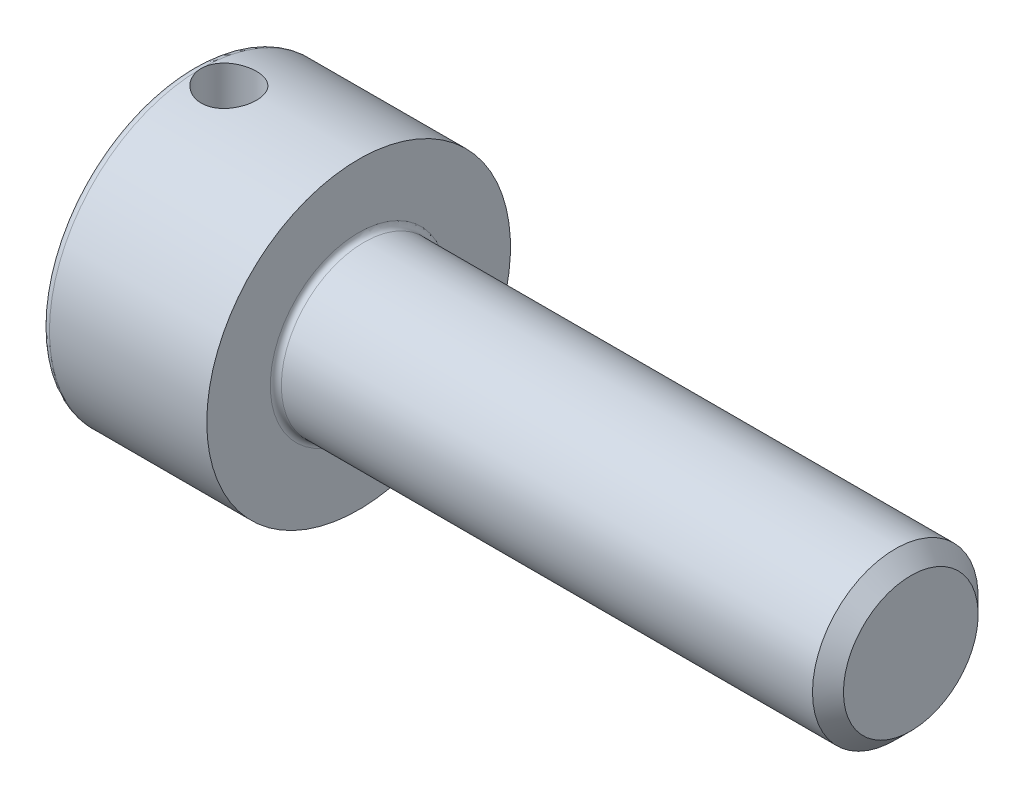
from build123d import *

# Parameters (mm, degrees)
FILLET1_R               = 0.1
FILLET2_R               = 0.15
HEX_2_DEPTH             = 1.3
CUT_EXTRUDE1_DEPTH      = 14.569266765
CUT_EXTRUDE1_DEPTH_BACK = 14.569266765
SKETCH4_R               = 0.5


with BuildPart() as part:
    # BodySke → Base-Revolve (revolve)
    with BuildSketch(Plane.XY, mode=Mode.PRIVATE) as base_revolve_sk:
        Polygon((0, 0), (0, 2.75), (3, 2.75), (3, 1.5), (12.7195, 1.5), (13, 1.2195), (13, 0), align=None)
    revolve(base_revolve_sk.sketch.rotate(Axis((-31.75, 0, 0), (1, 0, 0)), 90), axis=Axis((-31.75, 0, 0), (1, 0, 0)))

    # Fillet1
    fillet1_edges = [part.edges().sort_by_distance(p)[0] for p in [
        (3, 0, -1.5),
    ]]
    fillet(fillet1_edges, radius=FILLET1_R)

    # Fillet2
    fillet2_edges = [part.edges().sort_by_distance(p)[0] for p in [
        (0, 0, -2.75),
    ]]
    fillet(fillet2_edges, radius=FILLET2_R)

    # Sketch2 → Hex-PreBroach (revolve, cut)
    with BuildSketch(Plane.XY, mode=Mode.PRIVATE) as hex_prebroach_sk:
        Polygon((0, 1.28), (1.3, 1.28), (2.039008345, 0), (0, 0), align=None)
    revolve(hex_prebroach_sk.sketch.rotate(Axis((0, 0, 0), (1, 0, 0)), 90), axis=Axis((0, 0, 0), (1, 0, 0)), mode=Mode.SUBTRACT)

    # Sketch3 → Hex 2 (cut)
    with BuildSketch(Plane(origin=(0, 0, 0), x_dir=(0, 0.500000000000001, 0.866025403784438), z_dir=(-1, 0, 0))):
        Polygon((0.739008345, 1.28), (-0.739008345, 1.28), (-1.478016689, 0), (-0.739008345, -1.28), (0.739008345, -1.28), (1.478016689, 0), align=None)
    extrude(amount=-HEX_2_DEPTH, mode=Mode.SUBTRACT)

    # Sketch4 → Cut-Extrude1 (cut, two sides: drawn at the far end of the back side and taken through both)
    with BuildSketch(Plane(origin=(0, 0, 0), x_dir=(1, 0, 0), z_dir=(0, 1, 0)).offset(-CUT_EXTRUDE1_DEPTH_BACK)):
        with Locations(Location((0.65, 0, 0), (0, 0, 180))):
            Circle(SKETCH4_R)
    extrude(amount=CUT_EXTRUDE1_DEPTH + CUT_EXTRUDE1_DEPTH_BACK, mode=Mode.SUBTRACT)


solid = part.part
